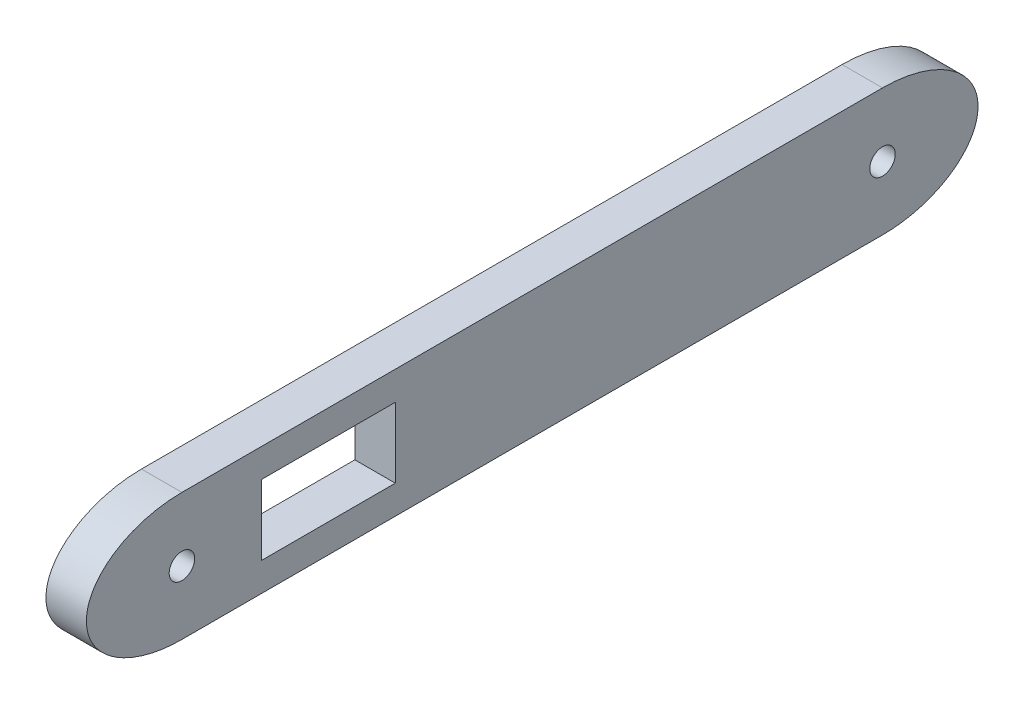
from build123d import *

# Parameters (mm, degrees)
SKETCH1_RX          = 30
SKETCH1_RY          = 20
SKETCH1_W           = 220
SKETCH1_H           = 40
BOSS_EXTRUDE1_DEPTH = 12.7
SKETCH2_R           = 4
SKETCH2_W           = 42
SKETCH2_H           = 22
CUT_EXTRUDE1_DEPTH  = 12.7


with BuildPart() as part:
    # Sketch1 → Boss-Extrude1 (new body)
    with BuildSketch(Plane(origin=(0, 0, 0), x_dir=(0, 0, -1), z_dir=(1, 0, 0))):
        with Locations(Location((-110, 0), (0, 0, 0))):
            Ellipse(SKETCH1_RX, SKETCH1_RY)
        with Locations(Location((110, 0), (0, 0, -180))):
            Ellipse(SKETCH1_RX, SKETCH1_RY)
        Rectangle(SKETCH1_W, SKETCH1_H)
    extrude(amount=BOSS_EXTRUDE1_DEPTH)

    # Sketch2 → Cut-Extrude1 (cut)
    with BuildSketch(Plane(origin=(12.7, 0, 0), x_dir=(0, 0, -1), z_dir=(1, 0, 0))):
        with Locations((-110, 0)):
            Circle(SKETCH2_R)
        with Locations(Location((110, 0, 0), (0, 0, 180))):
            Circle(SKETCH2_R)
        with Locations((-64, 0)):
            Rectangle(SKETCH2_W, SKETCH2_H)
    extrude(amount=-CUT_EXTRUDE1_DEPTH, mode=Mode.SUBTRACT)


solid = part.part
